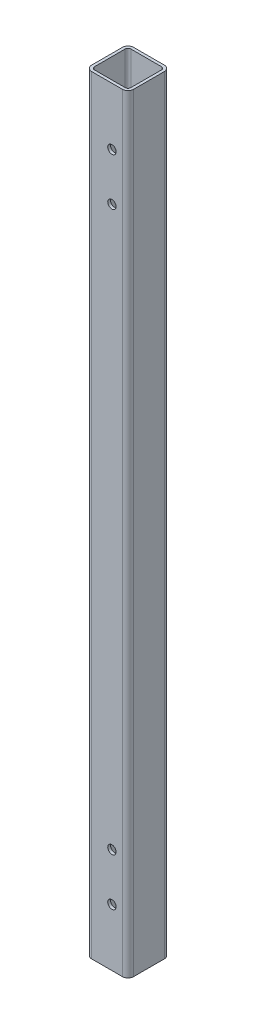
from build123d import *

# Parameters (mm, degrees)
EXTRUDE_1_DEPTH          = 275
CUT_EXTRUDE_1_DEPTH      = 276.816968296
CUT_EXTRUDE_1_DEPTH_BACK = 276.816968296
SKETCH_2_R               = 3


with BuildPart() as part:
    # 草图1 → 凸台-拉伸1 (new, symmetric)
    with BuildSketch(Plane(origin=(0, 0, 0), x_dir=(1, 0, 0), z_dir=(0, 1, 0))):
        with BuildLine():
            Line((-11, -15), (11, -15))
            ThreePointArc((11, -15), (13.828427125, -13.828427125), (15, -11))
            Line((15, -11), (15, 11))
            ThreePointArc((15, 11), (13.828427125, 13.828427125), (11, 15))
            Line((11, 15), (-11, 15))
            ThreePointArc((-11, 15), (-13.828427125, 13.828427125), (-15, 11))
            Line((-15, 11), (-15, -11))
            ThreePointArc((-15, -11), (-13.828427125, -13.828427125), (-11, -15))
        make_face()
        with BuildLine():
            Line((-11, -13), (11, -13))
            ThreePointArc((11, -13), (12.414213562, -12.414213562), (13, -11))
            Line((13, -11), (13, 11))
            ThreePointArc((13, 11), (12.414213562, 12.414213562), (11, 13))
            Line((11, 13), (-11, 13))
            ThreePointArc((-11, 13), (-12.414213562, 12.414213562), (-13, 11))
            Line((-13, 11), (-13, -11))
            ThreePointArc((-13, -11), (-12.414213562, -12.414213562), (-11, -13))
        make_face(mode=Mode.SUBTRACT)
    extrude(amount=EXTRUDE_1_DEPTH, both=True)

    # 草图2 → 切除-拉伸1 (cut, two sides: drawn at the far end of the back side and taken through both)
    with BuildSketch(Plane.XY.offset(-CUT_EXTRUDE_1_DEPTH_BACK)):
        with Locations((3.5, 233.969372655)):
            Circle(SKETCH_2_R)
        with Locations((3.5, 199.969372655)):
            Circle(SKETCH_2_R)
        with Locations((3.5, -199.969372655)):
            Circle(SKETCH_2_R)
        with Locations((3.5, -233.969372655)):
            Circle(SKETCH_2_R)
    extrude(amount=CUT_EXTRUDE_1_DEPTH + CUT_EXTRUDE_1_DEPTH_BACK, mode=Mode.SUBTRACT)


solid = part.part
